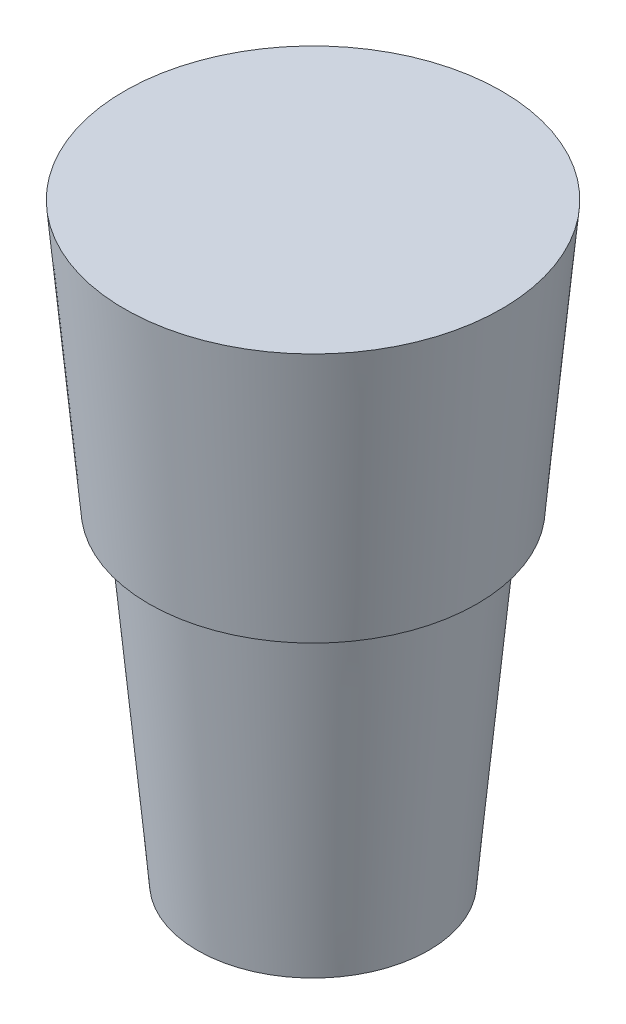
from build123d import *


with BuildPart() as part:
    # Sketch1 → Revolve1 (revolve)
    with BuildSketch(Plane.XY, mode=Mode.PRIVATE) as revolve1_sk:
        Polygon((-15.803195418, -39.107024929), (8.326804582, -39.107024929), (14.274321302, 25.662975071), (18.435613687, 28.576743367), (23.566804582, 84.456743367), (-15.803195418, 84.456743367), align=None)
    revolve(revolve1_sk.sketch.rotate(Axis((-15.803195418, -39.107024929, 0), (0, 1, 0)), 90), axis=Axis((-15.803195418, -39.107024929, 0), (0, 1, 0)))


solid = part.part
